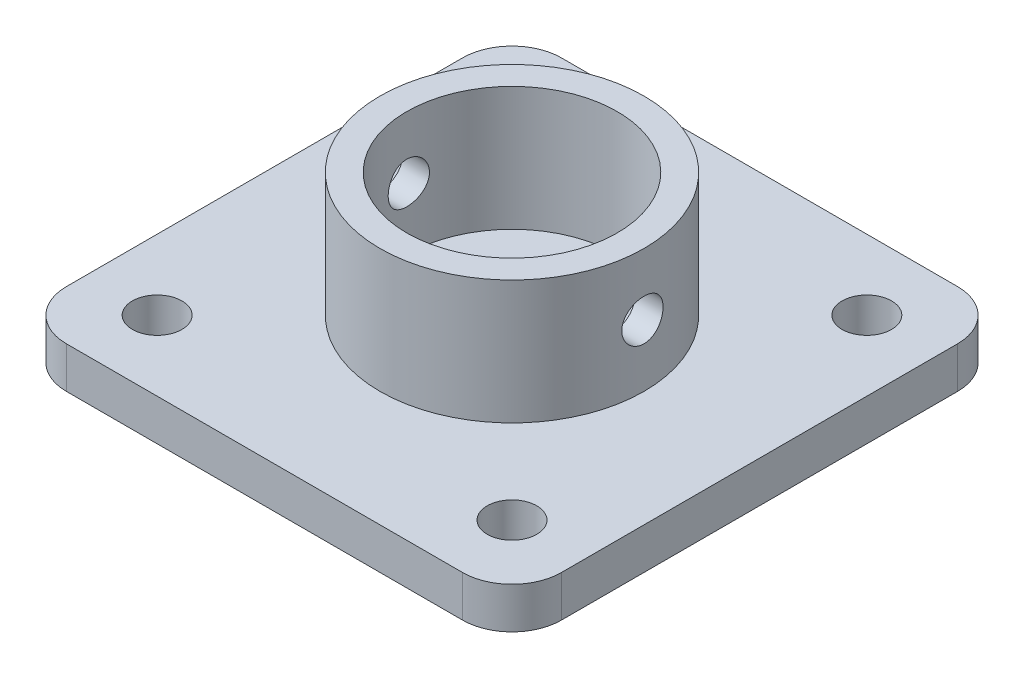
from build123d import *

# Parameters (mm, degrees)
SKETCH1_W               = 60
SKETCH1_H               = 60
SKETCH1_R               = 3
BOSS_EXTRUDE1_DEPTH     = 5
FILLET1_R               = 6
SKETCH2_R               = 16
SKETCH2_R_2             = 12.75
BOSS_EXTRUDE2_DEPTH     = 15
CUT_EXTRUDE1_DEPTH      = 47.904157598
CUT_EXTRUDE1_DEPTH_BACK = 47.904157598
SKETCH3_R               = 2.5


with BuildPart() as part:
    # Sketch1 → Boss-Extrude1 (new body)
    with BuildSketch(Plane(origin=(0, 0, 0), x_dir=(1, 0, 0), z_dir=(0, 1, 0))):
        Rectangle(SKETCH1_W, SKETCH1_H)
        with Locations(Location((21.5, 21.5, 0), (0, 0, 270))):
            Circle(SKETCH1_R, mode=Mode.SUBTRACT)
        with Locations(Location((-21.5, 21.5, 0), (0, 0, 270))):
            Circle(SKETCH1_R, mode=Mode.SUBTRACT)
        with Locations(Location((-21.5, -21.5, 0), (0, 0, 270))):
            Circle(SKETCH1_R, mode=Mode.SUBTRACT)
        with Locations(Location((21.5, -21.5, 0), (0, 0, 270))):
            Circle(SKETCH1_R, mode=Mode.SUBTRACT)
    extrude(amount=BOSS_EXTRUDE1_DEPTH)

    # Fillet1
    fillet1_edges = [part.edges().sort_by_distance(p)[0] for p in [
        (30, 2.5, 30),
        (-30, 2.5, 30),
        (-30, 2.5, -30),
        (30, 2.5, -30),
    ]]
    fillet(fillet1_edges, radius=FILLET1_R)

    # Sketch2 → Boss-Extrude2 (add)
    with BuildSketch(Plane(origin=(0, 5, 0), x_dir=(1, 0, 0), z_dir=(0, 1, 0))):
        with Locations(Location((0, 0, 0), (0, 0, 90))):
            Circle(SKETCH2_R)
        with Locations(Location((0, 0, 0), (0, 0, 270))):
            Circle(SKETCH2_R_2, mode=Mode.SUBTRACT)
    extrude(amount=BOSS_EXTRUDE2_DEPTH)

    # Sketch3 → Cut-Extrude1 (cut, two sides: drawn at the far end of the back side and taken through both)
    with BuildSketch(Plane(origin=(0, 0, 0), x_dir=(0, 0, -1), z_dir=(1, 0, 0)).offset(-CUT_EXTRUDE1_DEPTH_BACK)):
        with Locations((0, 12.5)):
            Circle(SKETCH3_R)
    extrude(amount=CUT_EXTRUDE1_DEPTH + CUT_EXTRUDE1_DEPTH_BACK, mode=Mode.SUBTRACT)


solid = part.part
